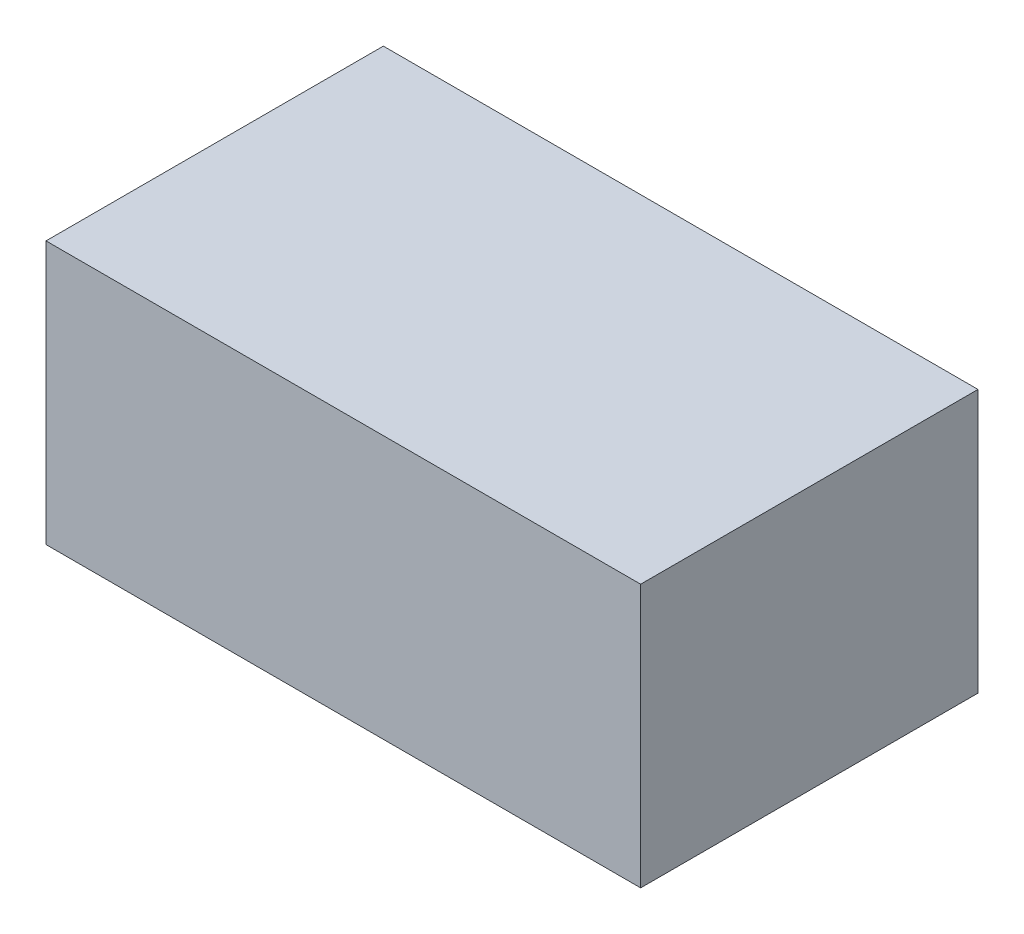
from build123d import *

# Parameters (mm, degrees)
SKETCH1_W           = 104
SKETCH1_H           = 59
BOSS_EXTRUDE1_DEPTH = 46


with BuildPart() as part:
    # Sketch1 → Boss-Extrude1 (new body)
    with BuildSketch(Plane(origin=(0, 0, 0), x_dir=(1, 0, 0), z_dir=(0, 1, 0))):
        with Locations((52, 29.5)):
            Rectangle(SKETCH1_W, SKETCH1_H)
    extrude(amount=BOSS_EXTRUDE1_DEPTH)


solid = part.part
